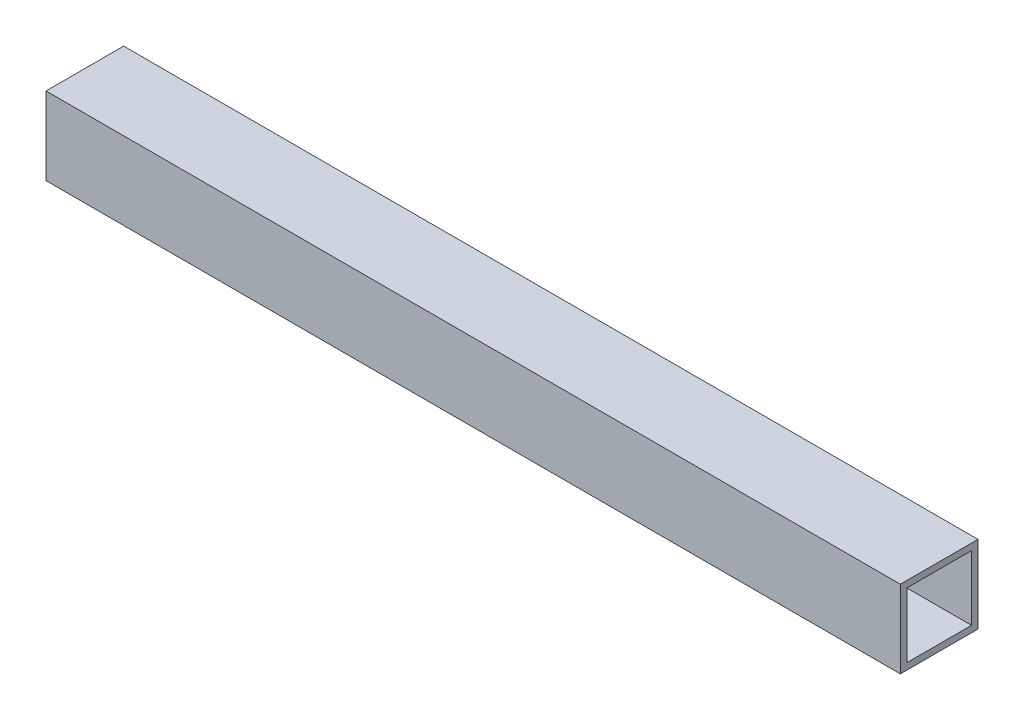
from build123d import *

# Parameters (mm, degrees)
SKETCH1_W                     = 19.05
SKETCH1_H                     = 19.05
SKETCH1_W_2                   = 15.875
SKETCH1_H_2                   = 15.875
BOSS_EXTRUDE1_DEPTH           = 104.775
SHELFBARMOUNTHOLE_REACH       = 108.918
SKETCH3_R                     = 2.4257
POWERSUPPLY_MOUNT_HOLES_REACH = 108.918
SKETCH4_R                     = 2.4257


with BuildPart() as part:
    # Sketch1 → Boss-Extrude1 (new, symmetric)
    with BuildSketch(Plane(origin=(0, 0, 0), x_dir=(0, -1, 0), z_dir=(1, 0, 0))):
        Rectangle(SKETCH1_W, SKETCH1_H)
        Rectangle(SKETCH1_W_2, SKETCH1_H_2, mode=Mode.SUBTRACT)
    extrude(amount=BOSS_EXTRUDE1_DEPTH, both=True)

    # Sketch3 → ShelfBarMountHole (cut, up to next)
    with BuildSketch(Plane.XZ.offset(9.525), mode=Mode.PRIVATE) as shelfbarmounthole_sk1:
        with Locations(Location((58.025000028, 0, 0), (0, 0, 270))):
            Circle(SKETCH3_R)
    shelfbarmounthole_tool1 = extrude(shelfbarmounthole_sk1.sketch, amount=-SHELFBARMOUNTHOLE_REACH, mode=Mode.PRIVATE) & part.part
    add(shelfbarmounthole_tool1.solids().sort_by_distance((58.025, -9.525, 0))[0], mode=Mode.SUBTRACT)

    # Sketch4 → PowerSupply Mount Holes (cut, up to next)
    with BuildSketch(Plane.XY.offset(-9.525), mode=Mode.PRIVATE) as powersupply_mount_holes_sk1:
        with Locations((-66.675, 0)):
            Circle(SKETCH4_R)
    powersupply_mount_holes_tool1 = extrude(powersupply_mount_holes_sk1.sketch, amount=POWERSUPPLY_MOUNT_HOLES_REACH, mode=Mode.PRIVATE) & part.part
    # Sketch4 → PowerSupply Mount Holes (cut, up to next)
    with BuildSketch(Plane.XY.offset(-9.525), mode=Mode.PRIVATE) as powersupply_mount_holes_sk2:
        with Locations((73.025, 0)):
            Circle(SKETCH4_R)
    powersupply_mount_holes_tool2 = extrude(powersupply_mount_holes_sk2.sketch, amount=POWERSUPPLY_MOUNT_HOLES_REACH, mode=Mode.PRIVATE) & part.part
    add(powersupply_mount_holes_tool1.solids().sort_by_distance((-66.675, 0, -9.525))[0], mode=Mode.SUBTRACT)
    add(powersupply_mount_holes_tool2.solids().sort_by_distance((73.025, 0, -9.525))[0], mode=Mode.SUBTRACT)


solid = part.part
